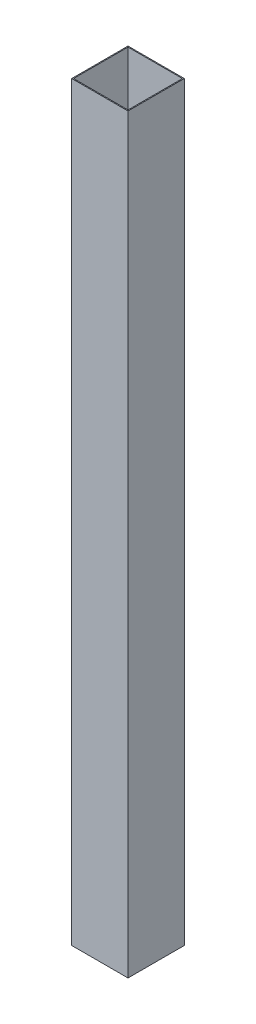
from build123d import *

# Parameters (mm, degrees)
SKETCH1_W           = 152.4
SKETCH1_H           = 152.4
SKETCH1_W_2         = 147.32
SKETCH1_H_2         = 147.32
BOSS_EXTRUDE1_DEPTH = 6604
SKETCH2_W           = 152.4
SKETCH2_H           = 4572
CUT_EXTRUDE1_DEPTH  = 6607.197711241


with BuildPart() as part:
    # Sketch1 → Boss-Extrude1 (new body)
    with BuildSketch(Plane(origin=(0, 0, 0), x_dir=(1, 0, 0), z_dir=(0, 1, 0))):
        Rectangle(SKETCH1_W, SKETCH1_H)
        Rectangle(SKETCH1_W_2, SKETCH1_H_2, mode=Mode.SUBTRACT)
    extrude(amount=BOSS_EXTRUDE1_DEPTH)

    # Sketch2 → Cut-Extrude1 (cut, through all)
    with BuildSketch(Plane.XY.offset(76.2)):
        with Locations((0, 4318)):
            Rectangle(SKETCH2_W, SKETCH2_H)
    extrude(amount=-CUT_EXTRUDE1_DEPTH, mode=Mode.SUBTRACT)


solid = part.part
